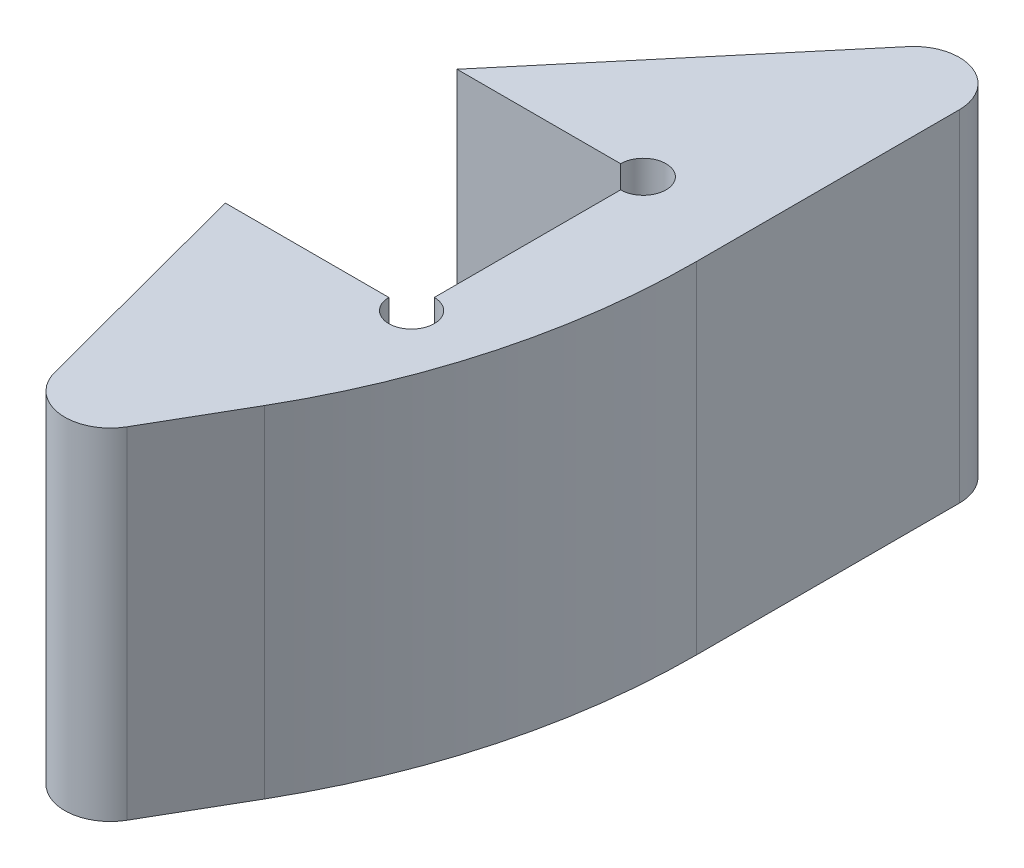
from build123d import *

# Parameters (mm, degrees)
SKETCH_1_W          = 8.2
SKETCH_1_H          = 10.2
SKETCH_1_R          = 1.75
EXTRUDE_1_DEPTH     = 15
SKETCH_2_W          = 8.2
SKETCH_2_H          = 10.2
CUT_EXTRUDE_1_DEPTH = 10
SKETCH_4_R          = 1
CUT_EXTRUDE_2_DEPTH = 10
FILLET_1_R          = 30
FILLET_2_R          = 2


with BuildPart() as part:
    # ｽｹｯﾁ1 → ﾎﾞｽ - 押し出し1 (new body)
    # profile 1 of 2: a face of its own
    with BuildSketch(Plane(origin=(0, 0, 0), x_dir=(1, 0, 0), z_dir=(0, 1, 0))):
        Polygon((-0.160254038, -20), (-4.1, -5.1), (4.1, -5.1), (4.1, 5.1), (-4.1, 5.1), (8.5, 20.1), (8.5, -5), align=None)
    # profile 2 of 2: a face of its own
    with BuildSketch(Plane(origin=(0, 0, 0), x_dir=(1, 0, 0), z_dir=(0, 1, 0))):
        Rectangle(SKETCH_1_W, SKETCH_1_H)
        with Locations(Location((0, 0, 0), (0, 0, 270))):
            Circle(SKETCH_1_R, mode=Mode.SUBTRACT)
    extrude(amount=EXTRUDE_1_DEPTH)

    # ｽｹｯﾁ2 → ｶｯﾄ - 押し出し1 (cut)
    with BuildSketch(Plane(origin=(0, 15, 0), x_dir=(1, 0, 0), z_dir=(0, 1, 0))):
        Rectangle(SKETCH_2_W, SKETCH_2_H)
    extrude(amount=-CUT_EXTRUDE_1_DEPTH, mode=Mode.SUBTRACT)

    # ｽｹｯﾁ4 → ｶｯﾄ - 押し出し2 (cut)
    with BuildSketch(Plane(origin=(0, 15, 0), x_dir=(1, 0, 0), z_dir=(0, 1, 0))):
        with Locations((4.1, 5.1)):
            Circle(SKETCH_4_R)
        with Locations((4.1, -5.1)):
            Circle(SKETCH_4_R)
    extrude(amount=-CUT_EXTRUDE_2_DEPTH, mode=Mode.SUBTRACT)

    # ﾌｨﾚｯﾄ1
    fillet_1_edges = [part.edges().sort_by_distance(p)[0] for p in [
        (8.5, 7.5, 5),
    ]]
    fillet(fillet_1_edges, radius=FILLET_1_R)

    # ﾌｨﾚｯﾄ2
    fillet_2_edges = [part.edges().sort_by_distance(p)[0] for p in [
        (8.5, 7.5, -20.1),
        (-0.160254038, 7.5, 20),
    ]]
    fillet(fillet_2_edges, radius=FILLET_2_R)


solid = part.part
